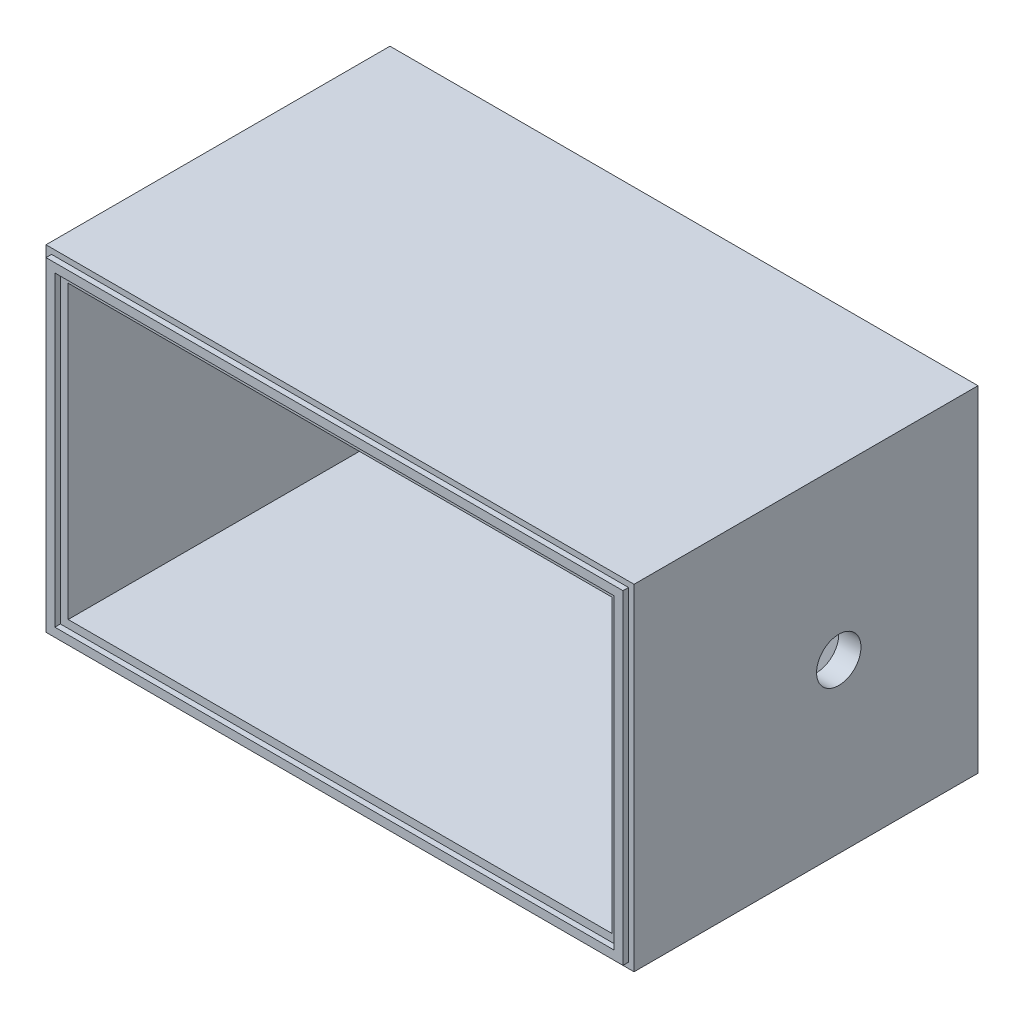
from build123d import *

# Parameters (mm, degrees)
EXTRUDE_1_DEPTH          = 27
EXTRUDE_1_DEPTH_BACK     = 4
SKETCH_1_W               = 53
SKETCH_1_H               = 30.25
SKETCH_2_W               = 49
SKETCH_2_H               = 26.25
CUT_EXTRUDE_1_DEPTH      = 28.2
SKETCH_3_W               = 52
SKETCH_3_H               = 29.25
SKETCH_3_W_2             = 50.4
SKETCH_3_H_2             = 27.65
CUT_EXTRUDE_2_DEPTH      = 1
CUT_EXTRUDE_3_REACH      = 45.497
SKETCH_4_R               = 1
SKETCH_5_R               = 1.55
CUT_EXTRUDE_4_DEPTH      = 1
MIRROR_2_COPY_1_REACH    = 45.497
MIRROR_2_COPY_1_SKETCH_R = 1
MIRROR_2_COPY_2_SKETCH_R = 1.55
MIRROR_2_COPY_2_DEPTH    = 1
SKETCH_7_R               = 2
CUT_EXTRUDE_6_DEPTH      = 60.655390578
SKETCH_8_W               = 52
SKETCH_8_H               = 29.25
SKETCH_8_W_2             = 50.4
SKETCH_8_H_2             = 27.65
EXTRUDE_2_DEPTH          = 1.5


with BuildPart() as part:
    # 草图1 → 凸台-拉伸1 (new, two sides: drawn at the far end of the back side and taken through both)
    with BuildSketch(Plane.XY.offset(-EXTRUDE_1_DEPTH_BACK)):
        Rectangle(SKETCH_1_W, SKETCH_1_H)
    extrude(amount=EXTRUDE_1_DEPTH + EXTRUDE_1_DEPTH_BACK)

    # 草图2 → 切除-拉伸1 (cut)
    with BuildSketch(Plane.XY.offset(27)):
        Rectangle(SKETCH_2_W, SKETCH_2_H)
    extrude(amount=-CUT_EXTRUDE_1_DEPTH, mode=Mode.SUBTRACT)

    # 草图3 → 切除-拉伸2 (cut)
    with BuildSketch(Plane.XY.offset(27)):
        Rectangle(SKETCH_3_W, SKETCH_3_H)
        Rectangle(SKETCH_3_W_2, SKETCH_3_H_2, mode=Mode.SUBTRACT)
    extrude(amount=-CUT_EXTRUDE_2_DEPTH, mode=Mode.SUBTRACT)

    # 草图4 → 切除-拉伸3 (cut, up to next)
    with BuildSketch(Plane(origin=(0, 0, -4), x_dir=(-1, 0, 0), z_dir=(0, 0, -1)), mode=Mode.PRIVATE) as cut_extrude_3_sk1:
        with Locations((-22.65, 11.275)):
            Circle(SKETCH_4_R)
    cut_extrude_3_tool1 = extrude(cut_extrude_3_sk1.sketch, amount=-CUT_EXTRUDE_3_REACH, mode=Mode.PRIVATE) & part.part
    cut_extrude_3 = cut_extrude_3_tool1.solids().sort_by_distance((22.65, 11.275, -4))[0]
    add(cut_extrude_3, mode=Mode.SUBTRACT)

    # 草图5 → 切除-拉伸4 (cut)
    with BuildSketch(Plane(origin=(0, 0, -4), x_dir=(-1, 0, 0), z_dir=(0, 0, -1))):
        with Locations((-22.65, 11.275)):
            Circle(SKETCH_5_R)
    cut_extrude_4 = extrude(amount=-CUT_EXTRUDE_4_DEPTH, mode=Mode.SUBTRACT)

    # 镜向1: 切除-拉伸3, 切除-拉伸4 across plane
    add(cut_extrude_3.mirror(Plane.ZX), mode=Mode.SUBTRACT)
    add(cut_extrude_4.mirror(Plane.ZX), mode=Mode.SUBTRACT)

    # 镜向2: 切除-拉伸3, 切除-拉伸4 across plane
    add(cut_extrude_3.mirror(Plane(origin=(0, 0, 0), x_dir=(0, 0, 1), z_dir=(1, 0, 0))), mode=Mode.SUBTRACT)
    add(cut_extrude_4.mirror(Plane(origin=(0, 0, 0), x_dir=(0, 0, 1), z_dir=(1, 0, 0))), mode=Mode.SUBTRACT)

    # 镜向2 copy 1 sketch → 镜向2 copy 1 (cut, up to next)
    with BuildSketch(Plane(origin=(0, 0, -4), x_dir=(1, 0, 0), z_dir=(0, 0, -1)), mode=Mode.PRIVATE) as mirror_2_copy_1_sk1:
        with Locations((-22.65, 11.275)):
            Circle(MIRROR_2_COPY_1_SKETCH_R)
    mirror_2_copy_1_tool1 = extrude(mirror_2_copy_1_sk1.sketch, amount=-MIRROR_2_COPY_1_REACH, mode=Mode.PRIVATE) & part.part
    add(mirror_2_copy_1_tool1.solids().sort_by_distance((-22.65, -11.275, -4))[0], mode=Mode.SUBTRACT)

    # 镜向2 copy 2 sketch → 镜向2 copy 2 (cut)
    with BuildSketch(Plane(origin=(0, 0, -4), x_dir=(1, 0, 0), z_dir=(0, 0, -1))):
        with Locations((-22.65, 11.275)):
            Circle(MIRROR_2_COPY_2_SKETCH_R)
    extrude(amount=-MIRROR_2_COPY_2_DEPTH, mode=Mode.SUBTRACT)

    # 草图7 → 切除-拉伸6 (cut, through all)
    with BuildSketch(Plane.ZY.offset(-24.5)):
        with Locations((8.54820427, 0)):
            Circle(SKETCH_7_R)
    extrude(amount=-CUT_EXTRUDE_6_DEPTH, mode=Mode.SUBTRACT)

    # 草图8 → 凸台-拉伸2 (add)
    with BuildSketch(Plane.XY.offset(26)):
        Rectangle(SKETCH_8_W, SKETCH_8_H)
        Rectangle(SKETCH_8_W_2, SKETCH_8_H_2, mode=Mode.SUBTRACT)
    extrude(amount=EXTRUDE_2_DEPTH)


solid = part.part
